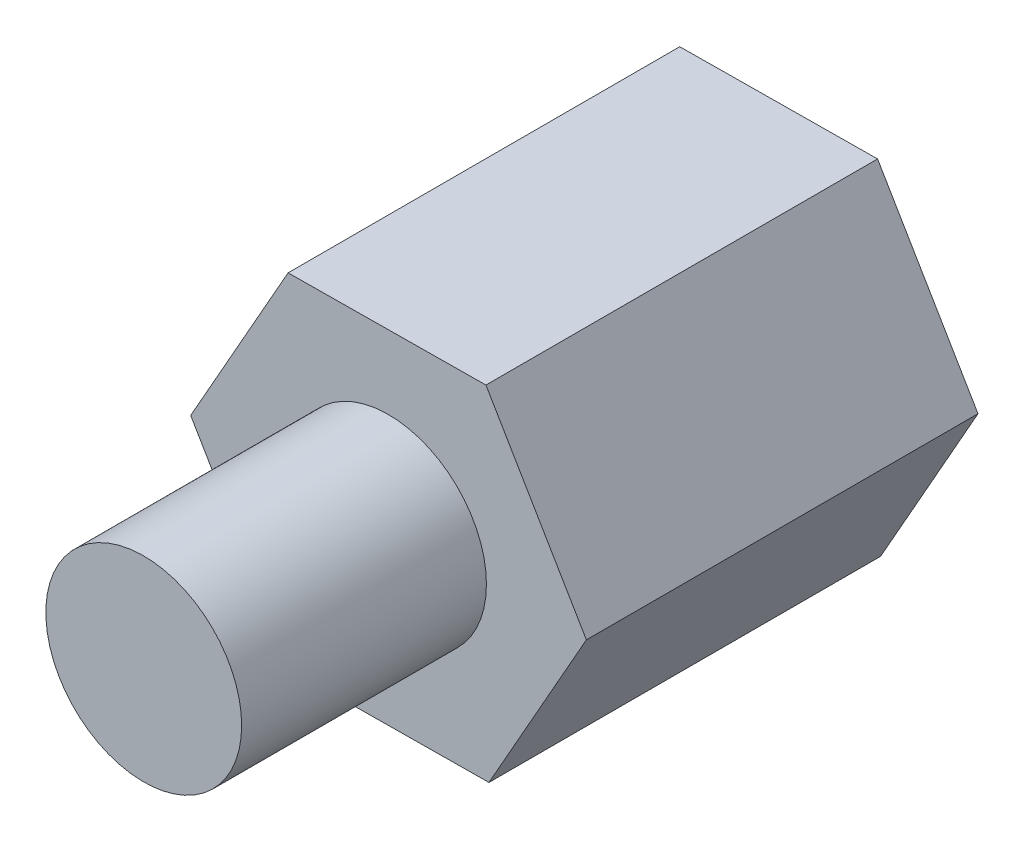
from build123d import *

# Parameters (mm, degrees)
SKETCH_1_R      = 2
EXTRUDE_1_DEPTH = 8
SKETCH_3_R      = 2
EXTRUDE_2_DEPTH = 5


with BuildPart() as part:
    # 草图1 → 凸台-拉伸1 (new body)
    with BuildSketch(Plane.XY):
        Polygon((2.051456248, -3.482077052), (4.041295309, 0.035574699), (1.989839061, 3.517651751), (-2.051456248, 3.482077052), (-4.041295309, -0.035574699), (-1.989839061, -3.517651751), align=None)
        Circle(SKETCH_1_R, mode=Mode.SUBTRACT)
    extrude(amount=EXTRUDE_1_DEPTH)


with BuildPart() as body_2:
    # 草图3 → 凸台-拉伸2 (new body)
    with BuildSketch(Plane.XY.offset(8)):
        Circle(SKETCH_3_R)
    extrude(amount=EXTRUDE_2_DEPTH)


solid = Compound([part.part, body_2.part])
